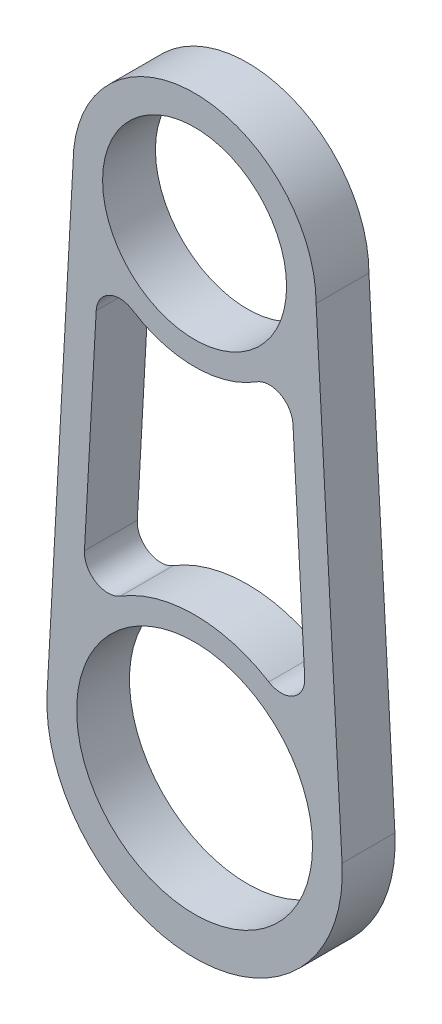
from build123d import *

# Parameters (mm, degrees)
SKETCH1_R           = 9.906
SKETCH1_R_2         = 12.7
BOSS_EXTRUDE1_DEPTH = 5.6896
FILLET1_R           = 2.54


with BuildPart() as part:
    # Sketch1 → Boss-Extrude1 (new body)
    with BuildSketch(Plane.XY):
        with BuildLine():
            ThreePointArc((13.085798561, 50.8), (0, 63.885798561), (-13.085798561, 50.8))
            Line((-13.085798561, 50.8), (-15.879798561, 0))
            ThreePointArc((-15.879798561, 0), (0, -16.777187541), (15.879798561, 0))
            Line((15.879798561, 0), (13.085798561, 50.8))
        make_face()
        with BuildLine():
            Line((-12.197482286, 9.136685717), (-10.290993585, 43.800116641))
            ThreePointArc((-10.290993585, 43.800116641), (0, 38.354), (10.290993585, 43.800116641))
            Line((10.290993585, 43.800116641), (12.197482286, 9.136685717))
            ThreePointArc((12.197482286, 9.136685717), (0, 15.24), (-12.197482286, 9.136685717))
        make_face(mode=Mode.SUBTRACT)
        with Locations((0, 50.8)):
            Circle(SKETCH1_R, mode=Mode.SUBTRACT)
        Circle(SKETCH1_R_2, mode=Mode.SUBTRACT)
    extrude(amount=BOSS_EXTRUDE1_DEPTH)

    # Fillet1
    fillet1_edges = [part.edges().sort_by_distance(p)[0] for p in [
        (-10.290993585, 43.800116641, 2.8448),
        (-12.197482286, 9.136685717, 2.8448),
        (12.197482286, 9.136685717, 2.8448),
        (10.290993585, 43.800116641, 2.8448),
    ]]
    fillet(fillet1_edges, radius=FILLET1_R)


solid = part.part
